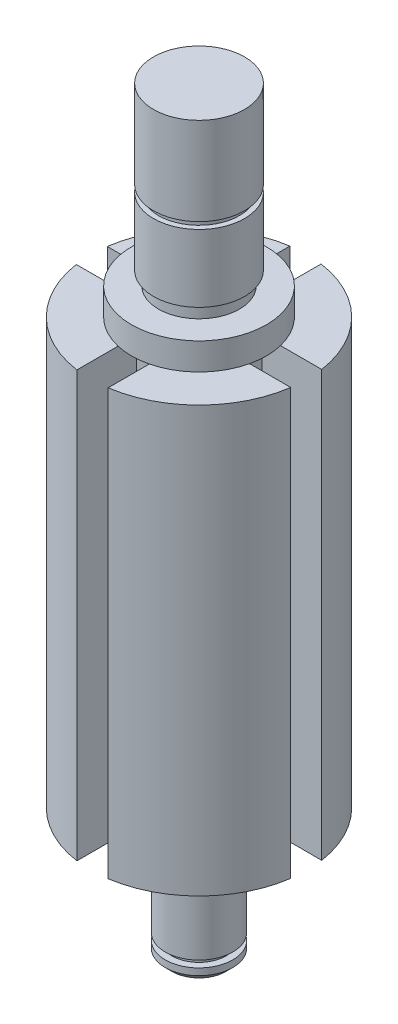
from build123d import *

# Parameters (mm, degrees)
BOSS_EXTRU_1_DEPTH  = 31.5
ESQUISSE3_R         = 3.5
BOSS_EXTRU_2_DEPTH  = 3
ESQUISSE5_R         = 2
BOSS_EXTRU_3_DEPTH  = 0.5
ESQUISSE6_R         = 2.5
BOSS_EXTRU_4_DEPTH  = 4.5
ESQUISSE8_R         = 2
BOSS_EXTRU_5_DEPTH  = 0.5
ESQUISSE9_R         = 2.5
BOSS_EXTRU_6_DEPTH  = 1
CHANFREIN1_SIZE     = 0.5
ESQUISSE10_R        = 5
BOSS_EXTRU_7_DEPTH  = 2
ESQUISSE11_R        = 3
BOSS_EXTRU_8_DEPTH  = 1
ESQUISSE13_R        = 3.375
BOSS_EXTRU_9_DEPTH  = 5
ESQUISSE15_R        = 3
BOSS_EXTRU_10_DEPTH = 0.5
ESQUISSE16_R        = 3.375
BOSS_EXTRU_11_DEPTH = 6.5


with BuildPart() as part:
    # Esquisse1 → Boss.-Extru.1 (new body)
    with BuildSketch(Plane(origin=(0, 0, 0), x_dir=(1, 0, 0), z_dir=(0, 1, 0))):
        with BuildLine():
            Line((1.18016373, -3.5), (1.18016373, -7.912472027))
            ThreePointArc((1.18016373, -7.912472027), (5.676756903, -5.636881324), (7.920594452, -1.124359161))
            Line((7.920594452, -1.124359161), (3.5, -1.124359161))
            Line((3.5, -1.124359161), (3.5, 1.18016373))
            Line((3.5, 1.18016373), (7.912472027, 1.18016373))
            ThreePointArc((7.912472027, 1.18016373), (5.636881324, 5.676756903), (1.124359161, 7.920594452))
            Line((1.124359161, 7.920594452), (1.124359161, 3.5))
            Line((1.124359161, 3.5), (-1.18016373, 3.5))
            Line((-1.18016373, 3.5), (-1.18016373, 7.912472027))
            ThreePointArc((-1.18016373, 7.912472027), (-5.676756903, 5.636881324), (-7.920594452, 1.124359161))
            Line((-7.920594452, 1.124359161), (-3.5, 1.124359161))
            Line((-3.5, 1.124359161), (-3.5, -1.18016373))
            Line((-3.5, -1.18016373), (-7.912472027, -1.18016373))
            ThreePointArc((-7.912472027, -1.18016373), (-5.636881324, -5.676756903), (-1.124359161, -7.920594452))
            Line((-1.124359161, -7.920594452), (-1.124359161, -3.5))
            Line((-1.124359161, -3.5), (1.18016373, -3.5))
        make_face()
    extrude(amount=BOSS_EXTRU_1_DEPTH)

    # Esquisse3 → Boss.-Extru.2 (add)
    with BuildSketch(Plane.XZ):
        with Locations(Location((0, 0, 0), (0, 0, 270))):
            Circle(ESQUISSE3_R)
    extrude(amount=BOSS_EXTRU_2_DEPTH)

    # Esquisse5 → Boss.-Extru.3 (add)
    with BuildSketch(Plane.XZ.offset(3)):
        with Locations(Location((0, 0, 0), (0, 0, 270))):
            Circle(ESQUISSE5_R)
    extrude(amount=BOSS_EXTRU_3_DEPTH)

    # Esquisse6 → Boss.-Extru.4 (add)
    with BuildSketch(Plane.XZ.offset(3.5)):
        with Locations(Location((0, 0, 0), (0, 0, 270))):
            Circle(ESQUISSE6_R)
    extrude(amount=BOSS_EXTRU_4_DEPTH)

    # Esquisse8 → Boss.-Extru.5 (add)
    with BuildSketch(Plane.XZ.offset(8)):
        with Locations(Location((0, 0, 0), (0, 0, 270))):
            Circle(ESQUISSE8_R)
    extrude(amount=BOSS_EXTRU_5_DEPTH)

    # Esquisse9 → Boss.-Extru.6 (add)
    with BuildSketch(Plane.XZ.offset(8.5)):
        with Locations(Location((0, 0, 0), (0, 0, 270))):
            Circle(ESQUISSE9_R)
    extrude(amount=BOSS_EXTRU_6_DEPTH)

    # Chanfrein1
    chanfrein1_edges = [part.edges().sort_by_distance(p)[0] for p in [
        (0, -9.5, 2.5),
    ]]
    chamfer(chanfrein1_edges, length=CHANFREIN1_SIZE)

    # Esquisse10 → Boss.-Extru.7 (add)
    with BuildSketch(Plane(origin=(0, 31.5, 0), x_dir=(1, 0, 0), z_dir=(0, 1, 0))):
        with Locations(Location((0, 0, 0), (0, 0, 77.004658444))):
            Circle(ESQUISSE10_R)
    extrude(amount=BOSS_EXTRU_7_DEPTH)

    # Esquisse11 → Boss.-Extru.8 (add)
    with BuildSketch(Plane(origin=(0, 33.5, 0), x_dir=(1, 0, 0), z_dir=(0, 1, 0))):
        with Locations(Location((0, 0, 0), (0, 0, 270))):
            Circle(ESQUISSE11_R)
    extrude(amount=BOSS_EXTRU_8_DEPTH)

    # Esquisse13 → Boss.-Extru.9 (add)
    with BuildSketch(Plane(origin=(0, 34.5, 0), x_dir=(1, 0, 0), z_dir=(0, 1, 0))):
        with Locations(Location((0, 0, 0), (0, 0, 270))):
            Circle(ESQUISSE13_R)
    extrude(amount=BOSS_EXTRU_9_DEPTH)

    # Esquisse15 → Boss.-Extru.10 (add)
    with BuildSketch(Plane(origin=(0, 39.5, 0), x_dir=(1, 0, 0), z_dir=(0, 1, 0))):
        with Locations(Location((0, 0, 0), (0, 0, 270))):
            Circle(ESQUISSE15_R)
    extrude(amount=BOSS_EXTRU_10_DEPTH)

    # Esquisse16 → Boss.-Extru.11 (add)
    with BuildSketch(Plane(origin=(0, 40, 0), x_dir=(1, 0, 0), z_dir=(0, 1, 0))):
        with Locations(Location((0, 0, 0), (0, 0, 270))):
            Circle(ESQUISSE16_R)
    extrude(amount=BOSS_EXTRU_11_DEPTH)


solid = part.part
